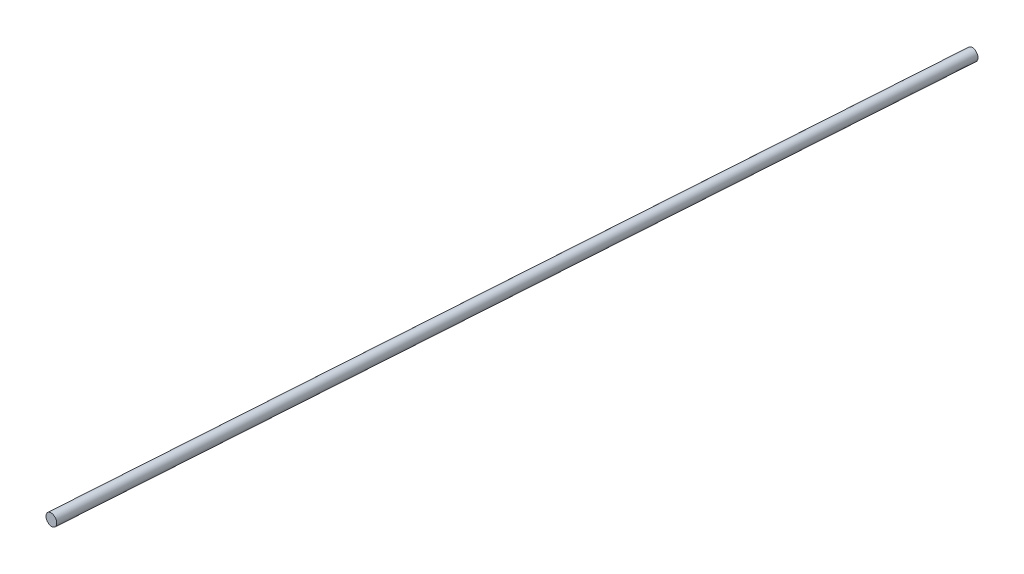
from build123d import *

# Parameters (mm, degrees)
SKETCH2_R           = 1
BOSS_EXTRUDE1_DEPTH = 150


with BuildPart() as part:
    # Sketch2 → Boss-Extrude1 (new body)
    with BuildSketch(Plane(origin=(40, 0, 273.745271122), x_dir=(0.997785157856609, 0, 0.06651901052377394), z_dir=(-0.06651901052377394, 0, 0.997785157856609))):
        with Locations((0.308824936, 0)):
            Circle(SKETCH2_R)
    extrude(amount=-BOSS_EXTRUDE1_DEPTH)


solid = part.part
